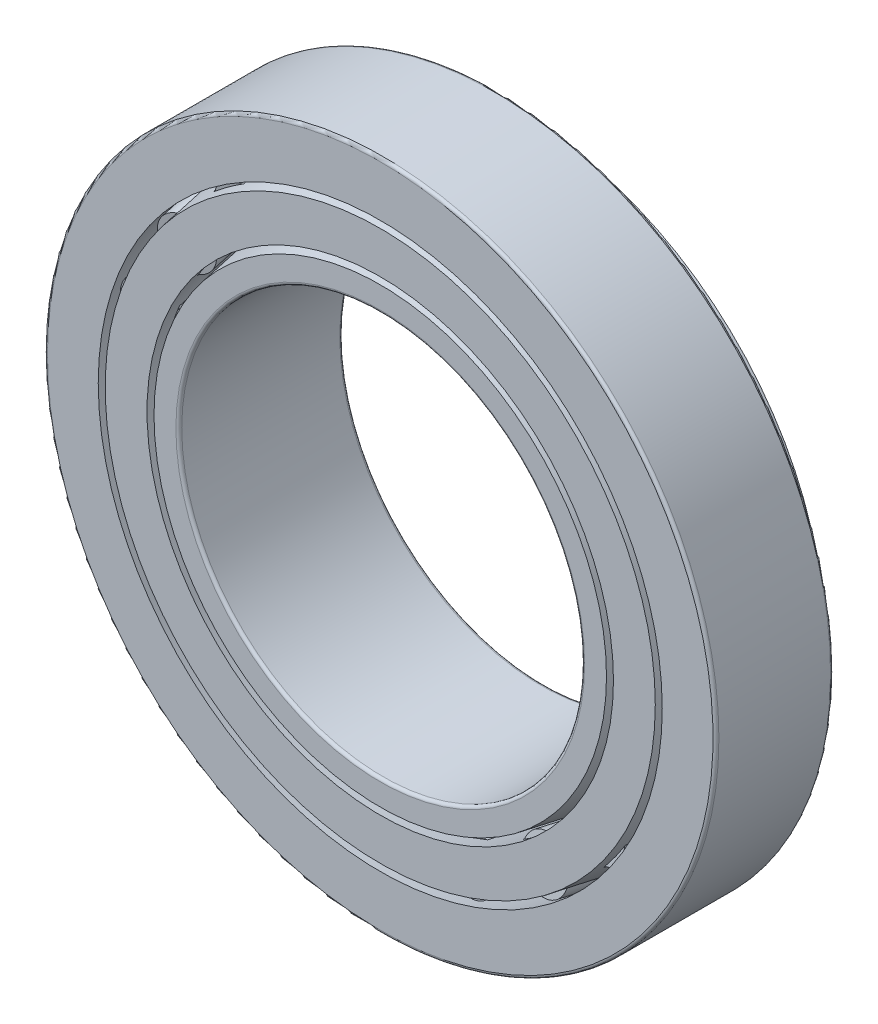
from build123d import *

# Parameters (mm, degrees)
CIRPATTERN1_COUNT = 20
CIRPATTERN2_COUNT = 20
FILLET1_R         = 0.555625
FILLET2_R         = 0.555625


with BuildPart() as part:
    # Sketch1 → Revolve1 (revolve)
    with BuildSketch(Plane(origin=(0, 0, 0), x_dir=(0, 0, -1), z_dir=(1, 0, 0)), mode=Mode.PRIVATE) as revolve1_sk:
        Polygon((-15.50035, 63.5), (6.72465, 63.5), (6.72465, 57.258867146), (-15.50035, 53.34), align=None)
    revolve(revolve1_sk.sketch.rotate(Axis((0, 0, 15.50035), (0, 0, -1)), 90), axis=Axis((0, 0, 15.50035), (0, 0, -1)))

    # Fillet1
    fillet1_edges = [part.edges().sort_by_distance(p)[0] for p in [
        (-63.5, 0, -6.72465),
        (-63.5, 0, 15.50035),
    ]]
    fillet(fillet1_edges, radius=FILLET1_R)


with BuildPart() as body_2:
    # Sketch5 → Revolve4 (revolve)
    with BuildSketch(Plane(origin=(0, 0, 0), x_dir=(0, 0, -1), z_dir=(1, 0, 0)), mode=Mode.PRIVATE) as revolve4_sk:
        Polygon((15.50035, 48.26), (-15.50035, 42.793740169), (-15.50035, 38.1), (15.50035, 38.1), align=None)
    revolve(revolve4_sk.sketch.rotate(Axis((0, 0, 15.50035), (0, 0, -1)), 90), axis=Axis((0, 0, 15.50035), (0, 0, -1)))

    # Fillet2
    fillet2_edges = [body_2.edges().sort_by_distance(p)[0] for p in [
        (-38.1, 0, 15.50035),
        (-38.1, 0, -15.50035),
    ]]
    fillet(fillet2_edges, radius=FILLET2_R)


with BuildPart() as body_3:
    # Sketch2 → Revolve2 (revolve)
    with BuildSketch(Plane(origin=(0, 0, 0), x_dir=(0, 0, -1), z_dir=(1, 0, 0)), mode=Mode.PRIVATE) as revolve2_sk:
        Polygon((-15.50035, 52.021717521), (-15.50035, 44.112022648), (6.72465, 48.030889794), (12.988910419, 49.13544792), (11.636272932, 56.806636309), (6.72465, 55.940584667), align=None)
    revolve(revolve2_sk.sketch.rotate(Axis((0, 0, 15.50035), (0, 0, -1)), 90), axis=Axis((0, 0, 15.50035), (0, 0, -1)))

    # Sketch3 → Cut-Revolve1 (revolve, cut)
    with BuildSketch(Plane(origin=(0, 0, 0), x_dir=(0, 0, -1), z_dir=(1, 0, 0))):
        Polygon((-12.795075026, 48.543883053), (-13.696833351, 53.658008645), (5.822891675, 57.099862824), (6.72465, 51.985737231), align=None)
    cut_revolve1 = revolve(axis=Axis((0, 48.066870085, 15.50035), (0, 0.17364817766692758, -0.9848077530122086)), mode=Mode.SUBTRACT)

    # CirPattern1: Cut-Revolve1 ×20 about axis
    cirpattern1_axis = Axis((0, 0, 0), (0, 0, 1))
    for i in range(1, CIRPATTERN1_COUNT):
        add(cut_revolve1.rotate(cirpattern1_axis, i * 360 / CIRPATTERN1_COUNT), mode=Mode.SUBTRACT)


with BuildPart() as body_4:
    # Sketch4 → Revolve3 (revolve)
    with BuildSketch(Plane(origin=(0, 0, 0), x_dir=(0, 0, -1), z_dir=(1, 0, 0)), mode=Mode.PRIVATE) as revolve3_sk:
        Polygon((-13.652726713, 53.407867476), (5.866998312, 56.849721654), (6.72465, 51.985737231), (-12.795075026, 48.543883053), align=None)
    revolve(revolve3_sk.sketch.rotate(Axis((0, 48.066870085, 15.50035), (0, 0.17364817766692758, -0.9848077530122086)), 180), axis=Axis((0, 48.066870085, 15.50035), (0, 0.17364817766692758, -0.9848077530122086)))


with BuildPart() as cirpattern2_1:
    # CirPattern2: pattern copy
    add(body_4.part.rotate(Axis((0, 0, 0), (0, 0, 1)), 1 * 360 / CIRPATTERN2_COUNT))


with BuildPart() as cirpattern2_2:
    # CirPattern2: pattern copy
    add(body_4.part.rotate(Axis((0, 0, 0), (0, 0, 1)), 2 * 360 / CIRPATTERN2_COUNT))


with BuildPart() as cirpattern2_3:
    # CirPattern2: pattern copy
    add(body_4.part.rotate(Axis((0, 0, 0), (0, 0, 1)), 3 * 360 / CIRPATTERN2_COUNT))


with BuildPart() as cirpattern2_4:
    # CirPattern2: pattern copy
    add(body_4.part.rotate(Axis((0, 0, 0), (0, 0, 1)), 4 * 360 / CIRPATTERN2_COUNT))


with BuildPart() as cirpattern2_5:
    # CirPattern2: pattern copy
    add(body_4.part.rotate(Axis((0, 0, 0), (0, 0, 1)), 5 * 360 / CIRPATTERN2_COUNT))


with BuildPart() as cirpattern2_6:
    # CirPattern2: pattern copy
    add(body_4.part.rotate(Axis((0, 0, 0), (0, 0, 1)), 6 * 360 / CIRPATTERN2_COUNT))


with BuildPart() as cirpattern2_7:
    # CirPattern2: pattern copy
    add(body_4.part.rotate(Axis((0, 0, 0), (0, 0, 1)), 7 * 360 / CIRPATTERN2_COUNT))


with BuildPart() as cirpattern2_8:
    # CirPattern2: pattern copy
    add(body_4.part.rotate(Axis((0, 0, 0), (0, 0, 1)), 8 * 360 / CIRPATTERN2_COUNT))


with BuildPart() as cirpattern2_9:
    # CirPattern2: pattern copy
    add(body_4.part.rotate(Axis((0, 0, 0), (0, 0, 1)), 9 * 360 / CIRPATTERN2_COUNT))


with BuildPart() as cirpattern2_10:
    # CirPattern2: pattern copy
    add(body_4.part.rotate(Axis((0, 0, 0), (0, 0, 1)), 10 * 360 / CIRPATTERN2_COUNT))


with BuildPart() as cirpattern2_11:
    # CirPattern2: pattern copy
    add(body_4.part.rotate(Axis((0, 0, 0), (0, 0, 1)), 11 * 360 / CIRPATTERN2_COUNT))


with BuildPart() as cirpattern2_12:
    # CirPattern2: pattern copy
    add(body_4.part.rotate(Axis((0, 0, 0), (0, 0, 1)), 12 * 360 / CIRPATTERN2_COUNT))


with BuildPart() as cirpattern2_13:
    # CirPattern2: pattern copy
    add(body_4.part.rotate(Axis((0, 0, 0), (0, 0, 1)), 13 * 360 / CIRPATTERN2_COUNT))


with BuildPart() as cirpattern2_14:
    # CirPattern2: pattern copy
    add(body_4.part.rotate(Axis((0, 0, 0), (0, 0, 1)), 14 * 360 / CIRPATTERN2_COUNT))


with BuildPart() as cirpattern2_15:
    # CirPattern2: pattern copy
    add(body_4.part.rotate(Axis((0, 0, 0), (0, 0, 1)), 15 * 360 / CIRPATTERN2_COUNT))


with BuildPart() as cirpattern2_16:
    # CirPattern2: pattern copy
    add(body_4.part.rotate(Axis((0, 0, 0), (0, 0, 1)), 16 * 360 / CIRPATTERN2_COUNT))


with BuildPart() as cirpattern2_17:
    # CirPattern2: pattern copy
    add(body_4.part.rotate(Axis((0, 0, 0), (0, 0, 1)), 17 * 360 / CIRPATTERN2_COUNT))


with BuildPart() as cirpattern2_18:
    # CirPattern2: pattern copy
    add(body_4.part.rotate(Axis((0, 0, 0), (0, 0, 1)), 18 * 360 / CIRPATTERN2_COUNT))


with BuildPart() as cirpattern2_19:
    # CirPattern2: pattern copy
    add(body_4.part.rotate(Axis((0, 0, 0), (0, 0, 1)), 19 * 360 / CIRPATTERN2_COUNT))


solid = Compound([part.part, body_2.part, body_3.part, body_4.part, cirpattern2_1.part, cirpattern2_2.part, cirpattern2_3.part, cirpattern2_4.part, cirpattern2_5.part, cirpattern2_6.part, cirpattern2_7.part, cirpattern2_8.part, cirpattern2_9.part, cirpattern2_10.part, cirpattern2_11.part, cirpattern2_12.part, cirpattern2_13.part, cirpattern2_14.part, cirpattern2_15.part, cirpattern2_16.part, cirpattern2_17.part, cirpattern2_18.part, cirpattern2_19.part])
